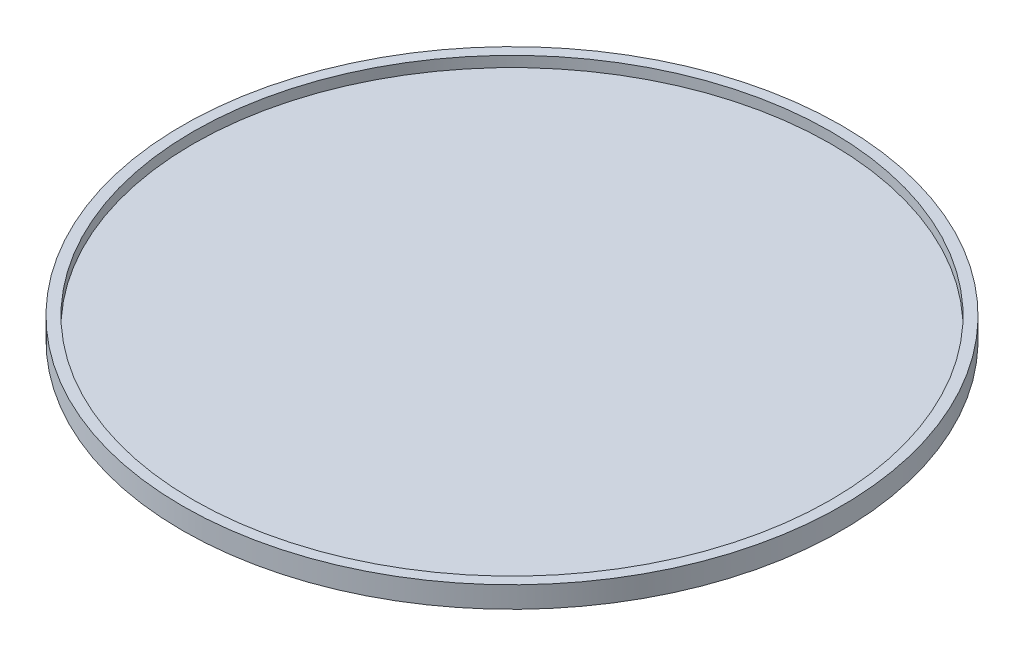
from build123d import *

# Parameters (mm, degrees)
SKETCH1_R           = 155
BOSS_EXTRUDE1_DEPTH = 5
SKETCH2_R           = 155
SKETCH2_R_2         = 150
BOSS_EXTRUDE2_DEPTH = 5


with BuildPart() as part:
    # Sketch1 → Boss-Extrude1 (new body)
    with BuildSketch(Plane(origin=(0, 0, 0), x_dir=(1, 0, 0), z_dir=(0, 1, 0))):
        with Locations(Location((0, 0, 0), (0, 0, 270))):
            Circle(SKETCH1_R)
    extrude(amount=BOSS_EXTRUDE1_DEPTH)

    # Sketch2 → Boss-Extrude2 (add)
    with BuildSketch(Plane(origin=(0, 5, 0), x_dir=(1, 0, 0), z_dir=(0, 1, 0))):
        with Locations(Location((0, 0, 0), (0, 0, 270))):
            Circle(SKETCH2_R)
        with Locations(Location((0, 0, 0), (0, 0, 270))):
            Circle(SKETCH2_R_2, mode=Mode.SUBTRACT)
    extrude(amount=BOSS_EXTRUDE2_DEPTH)


solid = part.part
